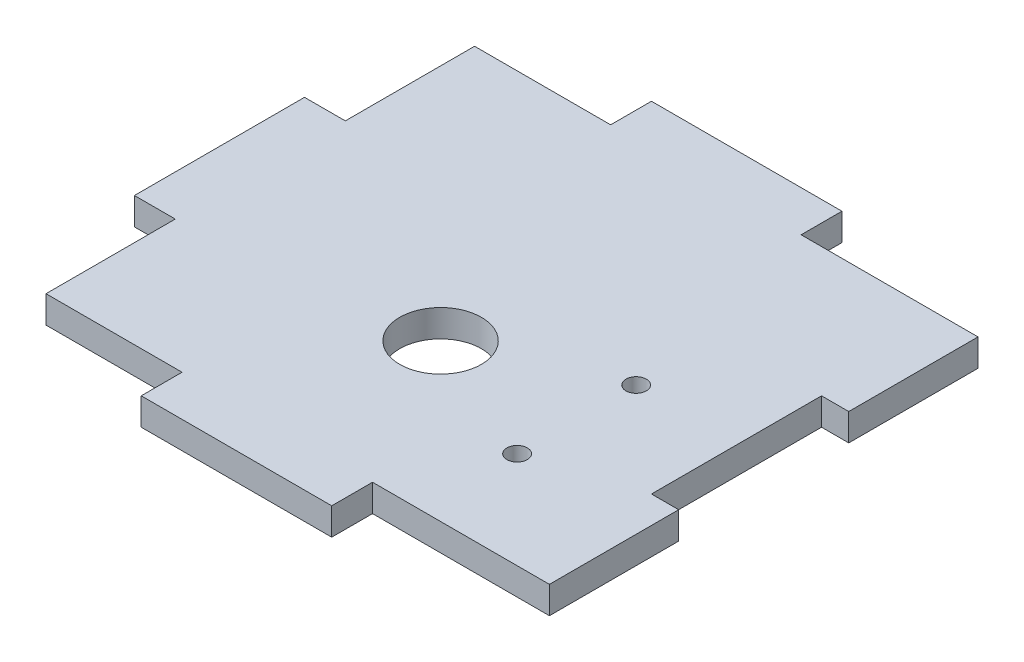
from build123d import *

# Parameters (mm, degrees)
SKETCH1_W           = 80
SKETCH1_H           = 75
BOSS_EXTRUDE1_DEPTH = 4
SKETCH2_R           = 6
SKETCH2_R_2         = 1.5
CUT_EXTRUDE1_DEPTH  = 110.731490467
SKETCH3_W           = 26
SKETCH3_H           = 6
SKETCH3_W_2         = 4
SKETCH3_H_2         = 25
CUT_EXTRUDE2_DEPTH  = 110.731490467


with BuildPart() as part:
    # Sketch1 → Boss-Extrude1 (new body)
    with BuildSketch(Plane(origin=(0, 0, 0), x_dir=(1, 0, 0), z_dir=(0, 1, 0))):
        with Locations((40, 37.5)):
            Rectangle(SKETCH1_W, SKETCH1_H)
    extrude(amount=BOSS_EXTRUDE1_DEPTH)

    # Sketch2 → Cut-Extrude1 (cut, through all)
    with BuildSketch(Plane(origin=(0, 4, 0), x_dir=(1, 0, 0), z_dir=(0, 1, 0))):
        with Locations(Location((41, 29, 0), (0, 0, 270))):
            Circle(SKETCH2_R)
        with Locations(Location((61, 37.75, 0), (0, 0, 270))):
            Circle(SKETCH2_R_2)
        with Locations(Location((61, 20.25, 0), (0, 0, 270))):
            Circle(SKETCH2_R_2)
    extrude(amount=-CUT_EXTRUDE1_DEPTH, mode=Mode.SUBTRACT)

    # Sketch3 → Cut-Extrude2 (cut, through all)
    with BuildSketch(Plane(origin=(0, 4, 0), x_dir=(1, 0, 0), z_dir=(0, 1, 0))):
        with Locations((67, 3)):
            Rectangle(SKETCH3_W, SKETCH3_H)
        with Locations((78, 37.5)):
            Rectangle(SKETCH3_W_2, SKETCH3_H_2)
        with Locations((67, 72)):
            Rectangle(SKETCH3_W, SKETCH3_H)
        Polygon((0, 75), (0, 50), (6, 50), (6, 69), (26, 69), (26, 75), align=None)
        Polygon((6, 25), (0, 25), (0, 0), (26, 0), (26, 6), (6, 6), align=None)
    extrude(amount=-CUT_EXTRUDE2_DEPTH, mode=Mode.SUBTRACT)


solid = part.part
